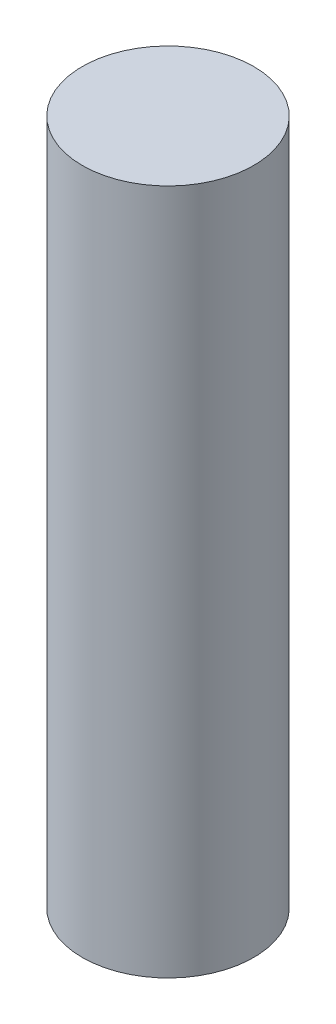
from build123d import *

# Parameters (mm, degrees)
SKETCH1_R           = 0.25
BOSS_EXTRUDE1_DEPTH = 2


with BuildPart() as part:
    # Sketch1 → Boss-Extrude1 (new body)
    with BuildSketch(Plane(origin=(0, 0, 0), x_dir=(1, 0, 0), z_dir=(0, 1, 0))):
        with Locations(Location((0, 0, 0), (0, 0, 270))):
            Circle(SKETCH1_R)
    extrude(amount=BOSS_EXTRUDE1_DEPTH)


solid = part.part
